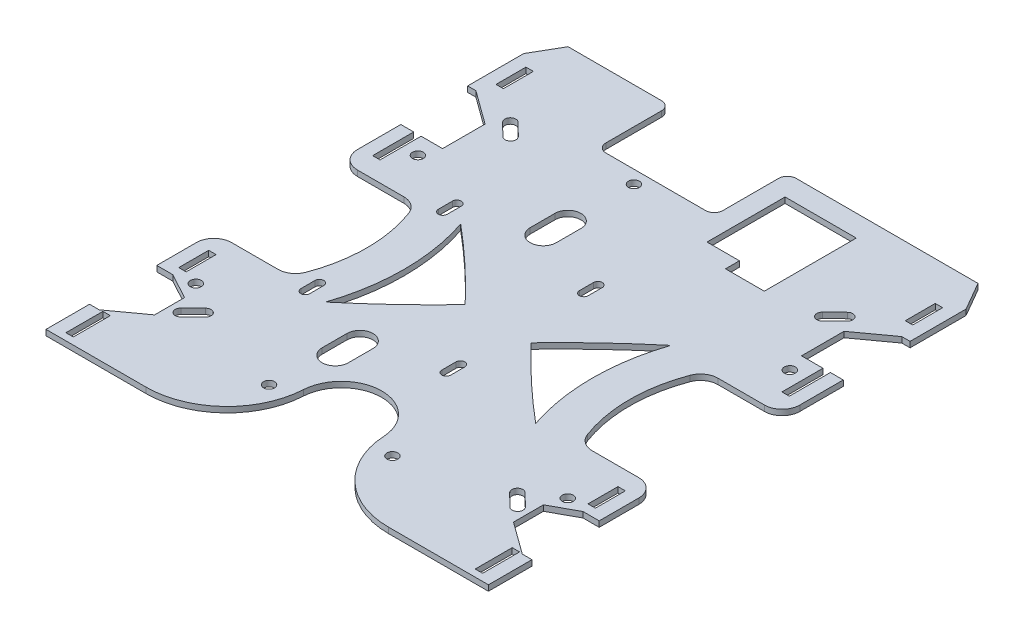
from build123d import *

# Parameters (mm, degrees)
SKETCH1_W              = 2.1
SKETCH1_H              = 8.5
SKETCH1_R              = 1.55
EXTRUDE_2824_DEPTH     = 1.6
SKETCH_1_W             = 33.213467336
SKETCH_1_H             = 20.75
CUT_EXTRUDE_3648_DEPTH = 109.487014406
FILLET1_R              = 5
SKETCH2_W              = 2.1
SKETCH2_H              = 2
SKETCH2_H_2            = 5
CUT_EXTRUDE_4412_DEPTH = 109.487014406
CUT_EXTRUDE_4934_DEPTH = 109.487014406
CUT_EXTRUDE_5290_DEPTH = 10
NUC_DEPTH              = 109.487014406
FILLET_1_R             = 2.5


with BuildPart() as part:
    # Sketch1 → Extrude 2824 (new body)
    with BuildSketch(Plane(origin=(0, 0, 0), x_dir=(1, 0, 0), z_dir=(0, 1, 0))):
        with BuildLine():
            Line((-62.75, 0), (-62.75, -55))
            Line((-62.75, -55), (-34.369560329, -55))
            ThreePointArc((-34.369560329, -55), (-18.59120626, -48.721265785), (-11.440696816, -33.31837076))
            ThreePointArc((-11.440696816, -33.31837076), (-7.872843983, -25.632867641), (0, -22.5))
            ThreePointArc((0, -22.5), (7.872843983, -25.632867641), (11.440696816, -33.31837076))
            ThreePointArc((11.440696816, -33.31837076), (18.59120626, -48.721265785), (34.369560329, -55))
            Line((34.369560329, -55), (62.75, -55))
            Line((62.75, -55), (62.75, 0))
            Line((62.75, 0), (62.75, 80.5))
            Line((62.75, 80.5), (58.140789302, 88.483387111))
            Line((58.140789302, 88.483387111), (-58.140789302, 88.483387111))
            Line((-58.140789302, 88.483387111), (-62.75, 80.5))
            Line((-62.75, 80.5), (-62.75, 0))
        make_face()
        with Locations((-58.05, -46.75)):
            Rectangle(SKETCH1_W, SKETCH1_H, mode=Mode.SUBTRACT)
        with Locations(Location((-52.75, -22.5, 0), (0, 0, 270))):
            Circle(SKETCH1_R, mode=Mode.SUBTRACT)
        with Locations(Location((-46, -30, 0), (0, 0, 270))):
            Circle(SKETCH1_R, mode=Mode.SUBTRACT)
        with Locations(Location((-17.5, -36.97765453, 0), (0, 0, 270))):
            Circle(SKETCH1_R, mode=Mode.SUBTRACT)
        with Locations((-58.05, -16.75)):
            Rectangle(SKETCH1_W, SKETCH1_H, mode=Mode.SUBTRACT)
        with Locations(Location((17.5, -36.97765453, 0), (0, 0, 270))):
            Circle(SKETCH1_R, mode=Mode.SUBTRACT)
        with Locations((58.05, -46.75)):
            Rectangle(SKETCH1_W, SKETCH1_H, mode=Mode.SUBTRACT)
        with Locations(Location((46, -30, 0), (0, 0, 270))):
            Circle(SKETCH1_R, mode=Mode.SUBTRACT)
        with Locations(Location((52.75, -22.5, 0), (0, 0, 270))):
            Circle(SKETCH1_R, mode=Mode.SUBTRACT)
        with Locations((58.05, -16.75)):
            Rectangle(SKETCH1_W, SKETCH1_H, mode=Mode.SUBTRACT)
        with Locations((-58.05, 43.25)):
            Rectangle(SKETCH1_W, SKETCH1_H, mode=Mode.SUBTRACT)
        with Locations(Location((-52.75, 40.5, 0), (0, 0, 270))):
            Circle(SKETCH1_R, mode=Mode.SUBTRACT)
        with Locations(Location((-46, 60, 0), (0, 0, 270))):
            Circle(SKETCH1_R, mode=Mode.SUBTRACT)
        with Locations((-58.05, 73.25)):
            Rectangle(SKETCH1_W, SKETCH1_H, mode=Mode.SUBTRACT)
        with Locations(Location((-15.000000144, 64.02234547, 0), (0, 0, 270))):
            Circle(SKETCH1_R, mode=Mode.SUBTRACT)
        with Locations(Location((52.75, 40.5, 0), (0, 0, 270))):
            Circle(SKETCH1_R, mode=Mode.SUBTRACT)
        with Locations((58.05, 43.25)):
            Rectangle(SKETCH1_W, SKETCH1_H, mode=Mode.SUBTRACT)
        Polygon((9.55, 60.2), (9.55, 82.35), (29.75, 82.35), (29.75, 56.25), (18.75, 56.25), (18.75, 60.2), align=None, mode=Mode.SUBTRACT)
        with Locations(Location((46, 60, 0), (0, 0, 270))):
            Circle(SKETCH1_R, mode=Mode.SUBTRACT)
        with Locations((58.05, 73.25)):
            Rectangle(SKETCH1_W, SKETCH1_H, mode=Mode.SUBTRACT)
    extrude(amount=EXTRUDE_2824_DEPTH)

    # 外部切除点示意-1 → Cut-Extrude 3648 (cut, through all)
    with BuildSketch(Plane(origin=(0, 0, 0), x_dir=(1, 0, 0), z_dir=(0, 1, 0))):
        with Locations((-12.540081807, 78.108387111)):
            Rectangle(SKETCH_1_W, SKETCH_1_H)
        with BuildLine():
            Line((-41.25, 28.319513771), (-62.75, 28.319513771))
            Line((-62.75, 28.319513771), (-62.75, -7.350545872))
            Line((-62.75, -7.350545872), (-41.285942601, -7.350545872))
            ThreePointArc((-41.285942601, -7.350545872), (-37.250021115, 10.480435299), (-41.25, 28.319513771))
        make_face()
        with BuildLine():
            Line((41.25, 28.319513771), (62.75, 28.319513771))
            Line((62.75, 28.319513771), (62.75, -7.350545872))
            Line((62.75, -7.350545872), (41.285942601, -7.350545872))
            ThreePointArc((41.285942601, -7.350545872), (37.250021115, 10.480435299), (41.25, 28.319513771))
        make_face()
        Polygon((60.40596468, 64.6074084), (50.906199984, 57.705425363), (50.906199984, 45.651396111), (62.75, 45.651396111), (62.75, 64.6074084), align=None)
        Polygon((-62.75, 64.6074084), (-60.40596468, 64.6074084), (-50.906199984, 57.705425363), (-50.906199984, 45.651396111), (-62.75, 45.651396111), align=None)
        Polygon((-62.75, -23.579530262), (-58.186951748, -23.579530262), (-50.906199866, -27.548162789), (-50.906199866, -36.042700547), (-60.003668341, -42.652398311), (-62.75, -42.652398311), align=None)
        Polygon((62.75, -23.579530262), (58.186951748, -23.579530262), (50.906199866, -27.548162789), (50.906199866, -36.042700547), (60.003668341, -42.652398311), (62.75, -42.652398311), align=None)
    extrude(amount=CUT_EXTRUDE_3648_DEPTH, mode=Mode.SUBTRACT)

    # Fillet1
    fillet1_edges = [part.edges().sort_by_distance(p)[0] for p in [
        (62.75, 0.8, 7.350545872),
        (62.75, 0.8, -28.319513771),
        (41.25, 0.8, -28.319513771),
        (41.285942601, 0.8, 7.350545872),
        (-41.285942601, 0.8, 7.350545872),
        (-41.25, 0.8, -28.319513771),
        (-62.75, 0.8, -28.319513771),
        (-62.75, 0.8, 7.350545872),
    ]]
    fillet(fillet1_edges, radius=FILLET1_R)

    # Sketch2 → Cut-Extrude 4412 (cut, through all)
    with BuildSketch(Plane(origin=(0, 1.6, 0), x_dir=(1, 0, 0), z_dir=(0, 1, 0))):
        with Locations((-58.05, -52)):
            Rectangle(SKETCH2_W, SKETCH2_H)
        with Locations((-58.05, 36.5)):
            Rectangle(SKETCH2_W, SKETCH2_H_2)
        with Locations((58.05, -52)):
            Rectangle(SKETCH2_W, SKETCH2_H)
        with Locations((58.05, 36.5)):
            Rectangle(SKETCH2_W, SKETCH2_H_2)
    extrude(amount=-CUT_EXTRUDE_4412_DEPTH, mode=Mode.SUBTRACT)

    # Sketch 4455 → Cut-Extrude 4934 (cut, through all)
    with BuildSketch(Plane(origin=(0, 0, 0), x_dir=(1, 0, 0), z_dir=(0, 1, 0))):
        with BuildLine():
            Line((-11.665602984, 45.664264408), (-11.665602984, 38.664264408))
            ThreePointArc((-11.665602984, 38.664264408), (-15.365602984, 34.964264408), (-19.065602984, 38.664264408))
            Line((-19.065602984, 38.664264408), (-19.065602984, 45.664264408))
            ThreePointArc((-19.065602984, 45.664264408), (-15.365602984, 49.364264408), (-11.665602984, 45.664264408))
        make_face()
        with BuildLine():
            Line((-11.665602984, -13.335735592), (-11.665602984, -20.335735592))
            ThreePointArc((-11.665602984, -20.335735592), (-15.365602984, -24.035735592), (-19.065602984, -20.335735592))
            Line((-19.065602984, -20.335735592), (-19.065602984, -13.335735592))
            ThreePointArc((-19.065602984, -13.335735592), (-15.365602984, -9.635735592), (-11.665602984, -13.335735592))
        make_face()
        with BuildLine():
            Line((5.884397016, 34.164264408), (5.884397016, 30.164264408))
            ThreePointArc((5.884397016, 30.164264408), (4.634397016, 28.914264408), (3.384397016, 30.164264408))
            Line((3.384397016, 30.164264408), (3.384397016, 34.164264408))
            ThreePointArc((3.384397016, 34.164264408), (4.634397016, 35.414264408), (5.884397016, 34.164264408))
        make_face()
        with BuildLine():
            Line((5.884397016, -8.835735592), (5.884397016, -4.835735592))
            ThreePointArc((5.884397016, -4.835735592), (4.634397016, -3.585735592), (3.384397016, -4.835735592))
            Line((3.384397016, -4.835735592), (3.384397016, -8.835735592))
            ThreePointArc((3.384397016, -8.835735592), (4.634397016, -10.085735592), (5.884397016, -8.835735592))
        make_face()
        with BuildLine():
            Line((-36.615602984, 34.164264408), (-36.615602984, 30.164264408))
            ThreePointArc((-36.615602984, 30.164264408), (-35.365602984, 28.914264408), (-34.115602984, 30.164264408))
            Line((-34.115602984, 30.164264408), (-34.115602984, 34.164264408))
            ThreePointArc((-34.115602984, 34.164264408), (-35.365602984, 35.414264408), (-36.615602984, 34.164264408))
        make_face()
        with BuildLine():
            Line((-36.615602984, -8.835735592), (-36.615602984, -4.835735592))
            ThreePointArc((-36.615602984, -4.835735592), (-35.365602984, -3.585735592), (-34.115602984, -4.835735592))
            Line((-34.115602984, -4.835735592), (-34.115602984, -8.835735592))
            ThreePointArc((-34.115602984, -8.835735592), (-35.365602984, -10.085735592), (-36.615602984, -8.835735592))
        make_face()
    extrude(amount=CUT_EXTRUDE_4934_DEPTH, mode=Mode.SUBTRACT)

    # 草图2 → Cut-Extrude 5290 (cut)
    with BuildSketch(Plane(origin=(0, 1.6, 0), x_dir=(1, 0, 0), z_dir=(0, 1, 0))):
        with BuildLine():
            ThreePointArc((9.371867176, 10.52234547), (19.323145451, 20.402758988), (29.820182402, 29.701292521))
            ThreePointArc((29.820182402, 29.701292521), (26.696086154, 10.52234547), (29.820182402, -8.65660158))
            ThreePointArc((29.820182402, -8.65660158), (19.323145451, 0.641931952), (9.371867176, 10.52234547))
        make_face()
        with BuildLine():
            ThreePointArc((-9.371867176, 10.52234547), (-19.323145451, 0.641931952), (-29.820182402, -8.65660158))
            ThreePointArc((-29.820182402, -8.65660158), (-26.696086154, 10.52234547), (-29.820182402, 29.701292521))
            ThreePointArc((-29.820182402, 29.701292521), (-19.323145451, 20.402758988), (-9.371867176, 10.52234547))
        make_face()
    extrude(amount=-CUT_EXTRUDE_5290_DEPTH, mode=Mode.SUBTRACT)

    # Sketch3 → NUC接口扩口 (cut, through all)
    with BuildSketch(Plane(origin=(0, 1.6, 0), x_dir=(1, 0, 0), z_dir=(0, 1, 0))):
        with BuildLine():
            Line((-46.703179123, 62.856228128), (-43.129008995, 59.359757351))
            ThreePointArc((-43.129008995, 59.359757351), (-43.104922196, 57.16785867), (-45.296820877, 57.143771872))
            Line((-45.296820877, 57.143771872), (-48.870991005, 60.640242649))
            ThreePointArc((-48.870991005, 60.640242649), (-48.895077804, 62.83214133), (-46.703179123, 62.856228128))
        make_face()
        with BuildLine():
            Line((-48.870991005, -30.640242649), (-45.296820877, -27.143771872))
            ThreePointArc((-45.296820877, -27.143771872), (-43.104922196, -27.16785867), (-43.129008995, -29.359757351))
            Line((-43.129008995, -29.359757351), (-46.703179123, -32.856228128))
            ThreePointArc((-46.703179123, -32.856228128), (-48.895077804, -32.83214133), (-48.870991005, -30.640242649))
        make_face()
        with BuildLine():
            Line((48.870991005, -30.640242649), (45.296820877, -27.143771872))
            ThreePointArc((45.296820877, -27.143771872), (43.104922196, -27.16785867), (43.129008995, -29.359757351))
            Line((43.129008995, -29.359757351), (46.703179123, -32.856228128))
            ThreePointArc((46.703179123, -32.856228128), (48.895077804, -32.83214133), (48.870991005, -30.640242649))
        make_face()
        with BuildLine():
            Line((46.703179123, 62.856228128), (43.129008995, 59.359757351))
            ThreePointArc((43.129008995, 59.359757351), (43.104922196, 57.16785867), (45.296820877, 57.143771872))
            Line((45.296820877, 57.143771872), (48.870991005, 60.640242649))
            ThreePointArc((48.870991005, 60.640242649), (48.895077804, 62.83214133), (46.703179123, 62.856228128))
        make_face()
    extrude(amount=-NUC_DEPTH, mode=Mode.SUBTRACT)

    # 圆角1
    fillet_1_edges = [part.edges().sort_by_distance(p)[0] for p in [
        (4.066651861, 0.8, -88.483387111),
        (-29.146815475, 0.8, -88.483387111),
        (-29.146815475, 0.8, -67.733387111),
        (4.066651861, 0.8, -67.733387111),
    ]]
    fillet(fillet_1_edges, radius=FILLET_1_R)


solid = part.part
